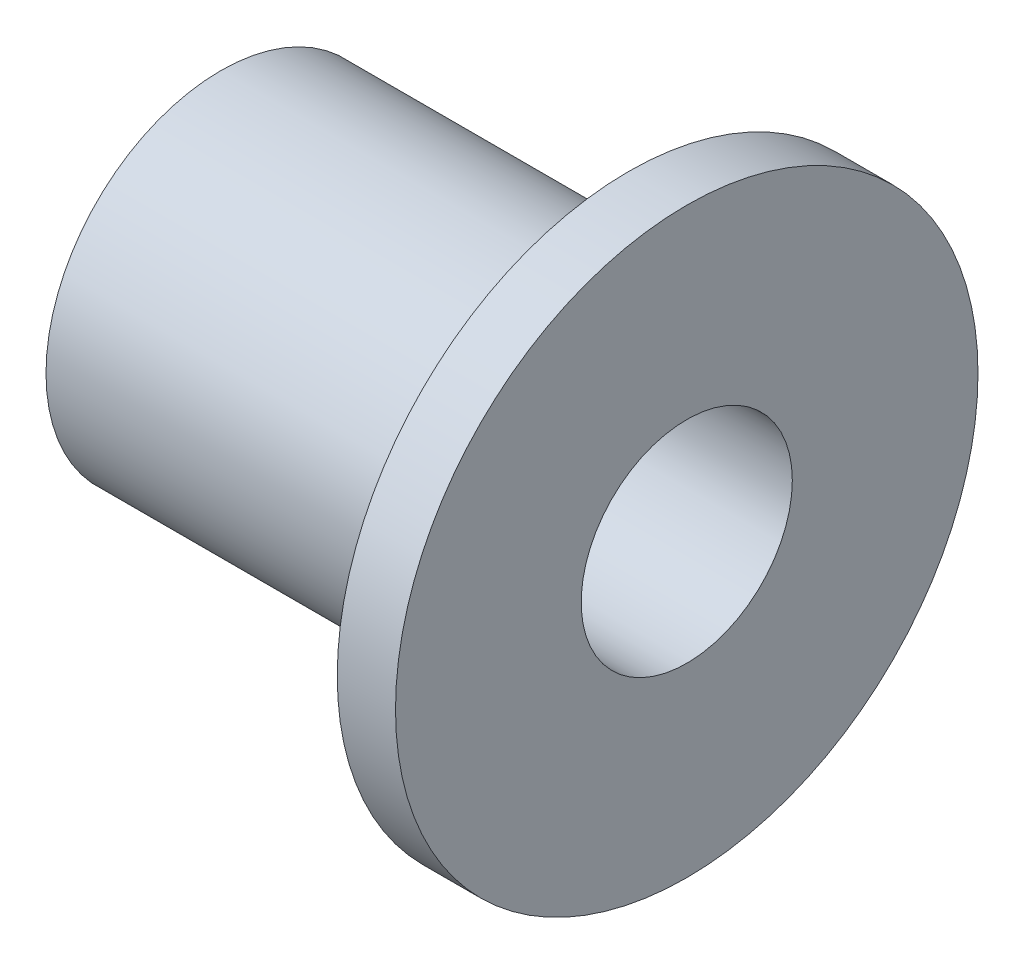
from build123d import *

# Parameters (mm, degrees)
F_1_2_20_TAPPED_HOLE1_D = 11.50874


with BuildPart() as part:
    # Sketch1 → Revolve1 (revolve)
    with BuildSketch(Plane.XY, mode=Mode.PRIVATE) as revolve1_sk:
        Polygon((0, 9.525), (22.225, 9.525), (22.225, 15.875), (25.4, 15.875), (25.4, 0), (0, 0), align=None)
    revolve(revolve1_sk.sketch.rotate(Axis((0, 0, 0), (1, 0, 0)), 90), axis=Axis((0, 0, 0), (1, 0, 0)))

    # 1/2-20 Tapped Hole1 (through all)
    with Locations(Plane(origin=(25.4, 0, 0), x_dir=(0, 0, 1), z_dir=(1, 0, 0))):
        with Locations((0, 0)):
            Hole(F_1_2_20_TAPPED_HOLE1_D / 2)


solid = part.part
